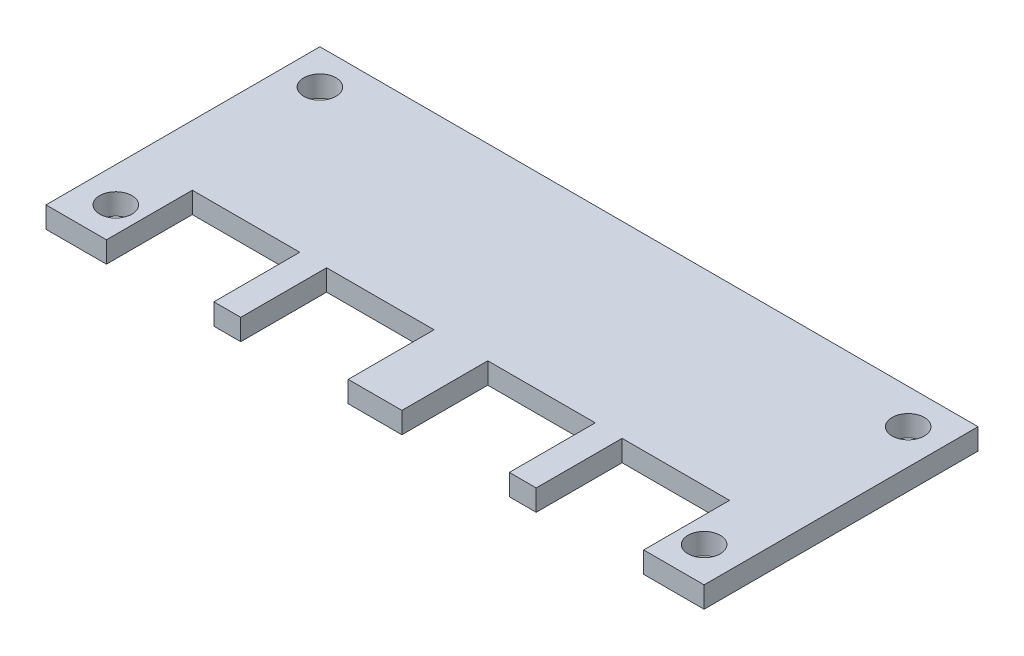
from build123d import *

# Parameters (mm, degrees)
SKETCH1_W           = 62.23
SKETCH1_H           = 25.9
BOSS_EXTRUDE1_DEPTH = 2
SKETCH2_R           = 1.524
SKETCH2_W           = 10.16
SKETCH2_H           = 8.12
CUT_EXTRUDE1_DEPTH  = 10


with BuildPart() as part:
    # Sketch1 → Boss-Extrude1 (new body)
    with BuildSketch(Plane(origin=(0, 0, 0), x_dir=(1, 0, 0), z_dir=(0, 1, 0))):
        with Locations((31.115, 12.95)):
            Rectangle(SKETCH1_W, SKETCH1_H)
    extrude(amount=BOSS_EXTRUDE1_DEPTH)

    # Sketch2 → Cut-Extrude1 (cut)
    with BuildSketch(Plane(origin=(0, 2, 0), x_dir=(1, 0, 0), z_dir=(0, 1, 0))):
        with Locations(Location((3.3, 22.6, 0), (0, 0, 270))):
            Circle(SKETCH2_R)
        with Locations(Location((3.3, 3.3, 0), (0, 0, 90))):
            Circle(SKETCH2_R)
        with Locations(Location((58.93, 3.3, 0), (0, 0, 270))):
            Circle(SKETCH2_R)
        with Locations(Location((58.93, 22.6, 0), (0, 0, 90))):
            Circle(SKETCH2_R)
        with Locations((38.735, 4.06)):
            Rectangle(SKETCH2_W, SKETCH2_H)
        with Locations((10.795, 4.06)):
            Rectangle(SKETCH2_W, SKETCH2_H)
        with Locations((51.435, 4.06)):
            Rectangle(SKETCH2_W, SKETCH2_H)
        with Locations((23.495, 4.06)):
            Rectangle(SKETCH2_W, SKETCH2_H)
    extrude(amount=-CUT_EXTRUDE1_DEPTH, mode=Mode.SUBTRACT)


solid = part.part
